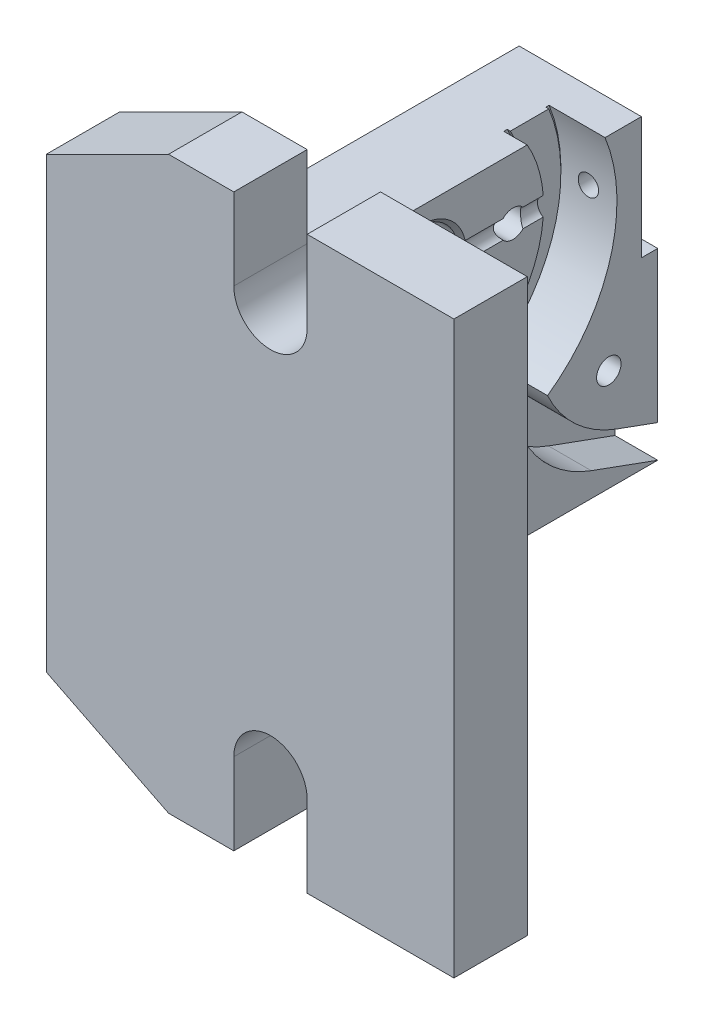
from build123d import *

# Parameters (mm, degrees)
EXTRUDE_1_DEPTH                  = 10.5
SKETCH_2_W                       = 102.00000000000001
SKETCH_2_H                       = 75.00000000000009
EXTRUDE_2_DEPTH                  = 19.4993693487819
EXTRUDE_3_DEPTH                  = 18.000000000000004
SKETCH_4_W                       = 18.000000000000004
SKETCH_4_H                       = 140
EXTRUDE_4_DEPTH                  = 70.0006306512181
EXTRUDE_START                    = 10.499999999999998
EXTRUDE_5_DEPTH                  = 10.499999999999998
CUT_EXTRUDE_1_REACH              = 194.401
SKETCH_7_W                       = 4.000000000000014
SKETCH_7_H                       = 29.999999999999993
CUT_EXTRUDE_2_DEPTH              = 201.0099997500125
CUT_EXTRUDE_3_DEPTH              = 210.76176963403032
CUT_EXTRUDE_4_DEPTH              = 210.76176963403032
EXTRUDE_6_DEPTH                  = 0.7500000000000007
HOLE_WIZARD_M521_D               = 61.5
EXTRUDE_7_DEPTH                  = 5.749999999999998
HOLE_WIZARD_6_7_6_7_1_AT_2_COUNT = 2
HOLE_WIZARD_6_7_6_7_1_AT_2_PITCH = 45
HOLE_WIZARD_4_0_4_1_AT_2_COUNT   = 2
HOLE_WIZARD_4_0_4_1_AT_2_PITCH   = 49.49747468305833
CHAMFER_1_SIZE                   = 0.9999999999999991
EXTRUDE_START_2                  = -16.249369
SKETCH_28_R                      = 3.35
SKETCH_28_R_2                    = 9.999999999999993
SKETCH_28_R_3                    = 3.350000000000003
EXTRUDE_8_DEPTH                  = 16.249369
SKETCH_30_R                      = 3.0000000000000018
CUT_EXTRUDE_5_DEPTH              = 7
EXTRUDE_START_3                  = -21.000000000000007
SKETCH_32_R                      = 2.9999999999999933
EXTRUDE_9_DEPTH                  = 21.000000000000007


with BuildPart() as part:
    # Эскиз1 → Бобышка-Вытянуть1 (new body)
    with BuildSketch(Plane(origin=(29.9993693487819, 0, 0), x_dir=(0, 0, -1), z_dir=(1, 0, 0))):
        with BuildLine():
            Line((14.919229074297327, 90.0005475751909), (0, 90.0005475751909))
            Line((0, 90.0005475751909), (0, 15.0005475751908))
            Line((0, 15.0005475751908), (102.00000000000001, 15.0005475751908))
            Line((102.00000000000001, 15.0005475751908), (85.69382268537409, 20.93551075238141))
            ThreePointArc((85.69382268537409, 20.93551075238141), (74.94644857866616, 27.70982740688085), (67.9664449575318, 38.324768093192546))
            ThreePointArc((67.9664449575318, 38.324768093192546), (24.088528585175357, 46.3477790832992), (14.919229074297327, 90.0005475751909))
        make_face()
    extrude(amount=-EXTRUDE_1_DEPTH)

    # Эскиз2 → Бобышка-Вытянуть2 (add)
    with BuildSketch(Plane.ZY.offset(-19.4993693487819)):
        with Locations((-51.00000000000001, 52.50054757519085)):
            Rectangle(SKETCH_2_W, SKETCH_2_H)
    extrude(amount=EXTRUDE_2_DEPTH)

    # Эскиз3 → Бобышка-Вытянуть3 (add)
    with BuildSketch(Plane.XY):
        Polygon((29.999369348781915, -6.94e-15), (3.47e-15, 15.000547575190799), (0, 124.997494914823), (29.997641385548, 140), (29.999369348781904, 140), align=None)
    extrude(amount=EXTRUDE_3_DEPTH)

    # Эскиз4 → Бобышка-Вытянуть4 (add)
    with BuildSketch(Plane(origin=(29.9993693487819, 0, 0), x_dir=(0, 0, -1), z_dir=(1, 0, 0))):
        with Locations((-9.000000000000002, 70)):
            Rectangle(SKETCH_4_W, SKETCH_4_H)
    extrude(amount=EXTRUDE_4_DEPTH)

    # Эскиз5 → Бобышка-Вытянуть5 (add)
    with BuildSketch(Plane(origin=(19.4993693487819, 0, 0), x_dir=(0, 0, -1), z_dir=(1, 0, 0)).offset(EXTRUDE_START)):
        with BuildLine():
            Line((89.08077092570272, 90.0005475751909), (102.00000000000001, 90.0005475751909))
            Line((102.00000000000001, 90.0005475751909), (102.00000000000001, 23.000547575190808))
            Line((102.00000000000001, 23.000547575190808), (91.92678266011816, 26.666898850201964))
            ThreePointArc((91.92678266011816, 26.666898850201964), (81.8910585435448, 32.765618882150974), (74.9654117449494, 42.24958224106233))
            ThreePointArc((74.9654117449494, 42.24958224106233), (90.35915387380979, 63.660894475956894), (89.08077092570272, 90.0005475751909))
        make_face()
    extrude(amount=-EXTRUDE_5_DEPTH)

    # Эскиз6 → Вырез-Вытянуть1 (cut, up to next)
    with BuildSketch(Plane(origin=(16.2493693487819, 0, 0), x_dir=(0, -1, 0), z_dir=(-1, 0, 0)), mode=Mode.PRIVATE) as cut_extrude_1_sk1:
        with BuildLine():
            Line((-90.0005475751909, -14.919229074297327), (-90.0005475751909, -89.08077092570272))
            ThreePointArc((-90.0005475751909, -89.08077092570272), (-34.999999999999936, -52), (-90.0005475751909, -14.919229074297327))
        make_face()
    cut_extrude_1_tool1 = extrude(cut_extrude_1_sk1.sketch, amount=-CUT_EXTRUDE_1_REACH, mode=Mode.PRIVATE) & part.part
    add(cut_extrude_1_tool1.solids().sort_by_distance((16.249369, 65.774947, -52))[0], mode=Mode.SUBTRACT)

    # Эскиз7 → Вырез-Вытянуть2 (cut, through all)
    with BuildSketch(Plane.ZY):
        with Locations((-100, 75.0005475751909)):
            Rectangle(SKETCH_7_W, SKETCH_7_H)
    extrude(amount=-CUT_EXTRUDE_2_DEPTH, mode=Mode.SUBTRACT)

    # Эскиз8 → Вырез-Вытянуть3 (cut, through all)
    with BuildSketch(Plane.XY.offset(18.000000000000004)):
        with BuildLine():
            Line((64, 140), (45.999999999999986, 140))
            Line((45.999999999999986, 140), (46, 120))
            ThreePointArc((46, 120), (55, 111), (64, 120))
            Line((64, 120), (64, 140))
        make_face()
    extrude(amount=-CUT_EXTRUDE_3_DEPTH, mode=Mode.SUBTRACT)

    # Эскиз9 → Вырез-Вытянуть4 (cut, through all)
    with BuildSketch(Plane.XY.offset(18.000000000000004)):
        with BuildLine():
            Line((46.00000000000001, 0), (64, 0))
            Line((64, 0), (64, 20.000000000000004))
            ThreePointArc((64, 20.000000000000004), (55, 29), (45.999999999999986, 20.000000000000004))
            Line((45.999999999999986, 20.000000000000004), (46.00000000000001, 0))
        make_face()
    extrude(amount=-CUT_EXTRUDE_4_DEPTH, mode=Mode.SUBTRACT)

    # Эскиз10 → Бобышка-Вытянуть6 (add)
    with BuildSketch(Plane(origin=(16.2493693487819, 0, 0), x_dir=(0, 0, -1), z_dir=(1, 0, 0))):
        with BuildLine():
            Line((15.729542704227807, 90.0005475751909), (88.27045729577222, 90.00054757519085))
            ThreePointArc((88.27045729577222, 90.00054757519085), (51.999999999999986, 35.75000000000001), (15.729542704227807, 90.0005475751909))
        make_face()
    extrude(amount=EXTRUDE_6_DEPTH)

    # Отверстие с зазором M521 (through all)
    with Locations(Plane(origin=(16.999369348781904, 0, 0), x_dir=(0, 0, -1), z_dir=(1, 0, 0))):
        with Locations((52, 75)):
            Hole(HOLE_WIZARD_M521_D / 2)

    # Эскиз20 → Диаметр отверстия Ø4.0 (4)1 (revolve, cut)
    with BuildSketch(Plane(origin=(16.999369348781904, 75, -17), x_dir=(0, 0, -1), z_dir=(0, 1, 0))):
        Polygon((0, 0), (-4.16e-15, 16.999369348781904), (1.9999999999999978, 16.999369348781904), (1.9999999999999896, -1.31e-15), align=None)
    hole_wizard_4_0_4_1 = revolve(axis=Axis((23.349369348781895, 75, -17), (-1, 0, 0)), mode=Mode.SUBTRACT)

    # Диаметр отверстия Ø4.0 (4)1 at 2: Диаметр отверстия Ø4.0 (4)1 ×2
    with Locations(*[Vector(0, -0.7071067811865475, -0.7071067811865477) * (i * HOLE_WIZARD_4_0_4_1_AT_2_PITCH) for i in range(1, HOLE_WIZARD_4_0_4_1_AT_2_COUNT)]):
        add(hole_wizard_4_0_4_1, mode=Mode.SUBTRACT)

    # Эскиз22 → Диаметр отверстия Ø6.0 (6)1 (revolve, cut)
    with BuildSketch(Plane(origin=(29.9993693487819, 40.0005475751908, -90), x_dir=(0, 0, -1), z_dir=(0, 1, 0))):
        Polygon((0, 0), (-7.35e-15, 30.000369348781906), (2.9999999999999867, 30.000369348781906), (2.9999999999999907, -1.19e-15), align=None)
    revolve(axis=Axis((36.34936934878189, 40.0005475751908, -90), (-1, 0, 0)), mode=Mode.SUBTRACT)


with BuildPart() as body_2:
    # Эскиз13 → Бобышка-Вытянуть7 (new body)
    with BuildSketch(Plane(origin=(16.2493693487819, 0, 0), x_dir=(0, -1, 0), z_dir=(-1, 0, 0))):
        with BuildLine():
            Line((-90.0005475751909, -26.01955403684463), (-90.0005475751909, -77.98044596315543))
            ThreePointArc((-90.0005475751909, -77.98044596315543), (-44.99999999999993, -51.99999999999999), (-90.0005475751909, -26.01955403684463))
        make_face()
    extrude(amount=-EXTRUDE_7_DEPTH)

    # Эскиз16 → Диаметр отверстия Ø6.7 (6.7)1 (revolve, cut)
    with BuildSketch(Plane(origin=(21.9993693487819, 75, -74.5), x_dir=(0, 0, -1), z_dir=(0, 1, 0))):
        Polygon((0, 0), (-1.41e-15, 5.7509999999999994), (3.3500000000000045, 5.7509999999999994), (3.3499999999999934, -1.15e-15), align=None)
    hole_wizard_6_7_6_7_1 = revolve(axis=Axis((28.34936934878189, 75, -74.5), (-1, 0, 0)), mode=Mode.SUBTRACT)

    # Диаметр отверстия Ø6.7 (6.7)1 at 2: Диаметр отверстия Ø6.7 (6.7)1 ×2
    with Locations(*[(0, 0, i * HOLE_WIZARD_6_7_6_7_1_AT_2_PITCH) for i in range(1, HOLE_WIZARD_6_7_6_7_1_AT_2_COUNT)]):
        add(hole_wizard_6_7_6_7_1, mode=Mode.SUBTRACT)

    # Эскиз18 → Диаметр отверстия Ø20.0 (20)1 (revolve, cut)
    with BuildSketch(Plane(origin=(21.9993693487819, 75, -52.00000000000001), x_dir=(0, 0, -1), z_dir=(0, 1, 0))):
        Polygon((0, 0), (-1.41e-15, 5.7510000000000066), (9.99999999999999, 5.7510000000000066), (9.99999999999999, -3.3e-16), align=None)
    revolve(axis=Axis((28.34936934878189, 75, -52.00000000000001), (-1, 0, 0)), mode=Mode.SUBTRACT)


with BuildPart() as hole_wizard_5_0_5_1_tool:
    # Эскиз24 → Диаметр отверстия Ø5.0 (5)1 (revolve)
    with BuildSketch(Plane(origin=(23, 75.0005475751909, -98), x_dir=(0, 1, 0), z_dir=(1, 0, 0))):
        Polygon((0, 0), (-1.127e-14, 45.999999999999986), (2.499999999999981, 45.999999999999986), (2.4999999999999867, -1.25e-15), align=None)
    revolve(axis=Axis((23, 75.0005475751909, -104.35), (0, 0, 1)))


with BuildPart() as part_1:
    add(part.part)

    # Диаметр отверстия Ø5.0 (5)1: cut by hole_wizard_5_0_5_1_tool
    add(hole_wizard_5_0_5_1_tool.part, mode=Mode.SUBTRACT)

    # Эскиз26 → Отверстие с зазором M61 (revolve, cut)
    with BuildSketch(Plane(origin=(15.8866729980809, 33.128633292951, -102.00000000000001), x_dir=(0, 1, 0), z_dir=(1, 0, 0))):
        Polygon((0, 0), (-1.47e-15, 5.999999999999993), (3.2357711959407984, 6.000000000000005), (3.2357711959408, -1.16e-15), align=None)
    revolve(axis=Axis((15.8866729980809, 33.128633292951, -108.35000000000001), (0, 0, 1)), mode=Mode.SUBTRACT)


with BuildPart() as body_2_1:
    add(body_2.part)

    # Диаметр отверстия Ø5.0 (5)1: cut by hole_wizard_5_0_5_1_tool
    add(hole_wizard_5_0_5_1_tool.part, mode=Mode.SUBTRACT)

    # Фаска1
    chamfer_1_edges = [body_2_1.edges().sort_by_distance(p)[0] for p in [
        (21.9993693487819, 74.99943746278025, -42.00000001582242),
    ]]
    chamfer(chamfer_1_edges, length=CHAMFER_1_SIZE)


with BuildPart() as extrude_8_tool:
    # Эскиз28 → Бобышка-Вытянуть8 (new body)
    with BuildSketch(Plane.ZY.offset(EXTRUDE_START_2)):
        with BuildLine():
            Line((-78.84298926059529, 90.0005475751909), (-25.157010739404722, 90.0005475751909))
            ThreePointArc((-25.157010739404722, 90.0005475751909), (-52.000000000000014, 44.250000000000014), (-78.84298926059529, 90.0005475751909))
        make_face()
        with Locations(Location((-29.500000000000004, 75, 0), (0, 0, 180))):
            Circle(SKETCH_28_R, mode=Mode.SUBTRACT)
        with Locations(Location((-52.00000000000001, 75, 0), (0, 0, 188.618876561))):
            Circle(SKETCH_28_R_2, mode=Mode.SUBTRACT)
        with Locations(Location((-74.5, 75, 0), (0, 0, 223.135094042))):
            Circle(SKETCH_28_R_3, mode=Mode.SUBTRACT)
    extrude(amount=EXTRUDE_8_DEPTH)


with BuildPart() as part_2:
    add(part_1.part)


with BuildPart() as part_3:
    # Бобышка-Вытянуть8: joined with extrude_8_tool
    add(part_2.part.fuse(extrude_8_tool.part, body_2_1.part, tol=0.00001))

    # Эскиз30 → Вырез-Вытянуть5 (cut)
    with BuildSketch(Plane.XZ.offset(-15.0005475751908)):
        with Locations(Location((19.9993693487819, -77.00000000000001, 0), (0, 0, 270))):
            Circle(SKETCH_30_R)
    extrude(amount=-CUT_EXTRUDE_5_DEPTH, mode=Mode.SUBTRACT)

    # Эскиз32 → Бобышка-Вытянуть9 (add)
    with BuildSketch(Plane.ZY.offset(EXTRUDE_START_3)):
        with Locations(Location((-90, 40.0005475751908, 0), (0, 0, 180))):
            Circle(SKETCH_32_R)
    extrude(amount=EXTRUDE_9_DEPTH)


solid = part_3.part
